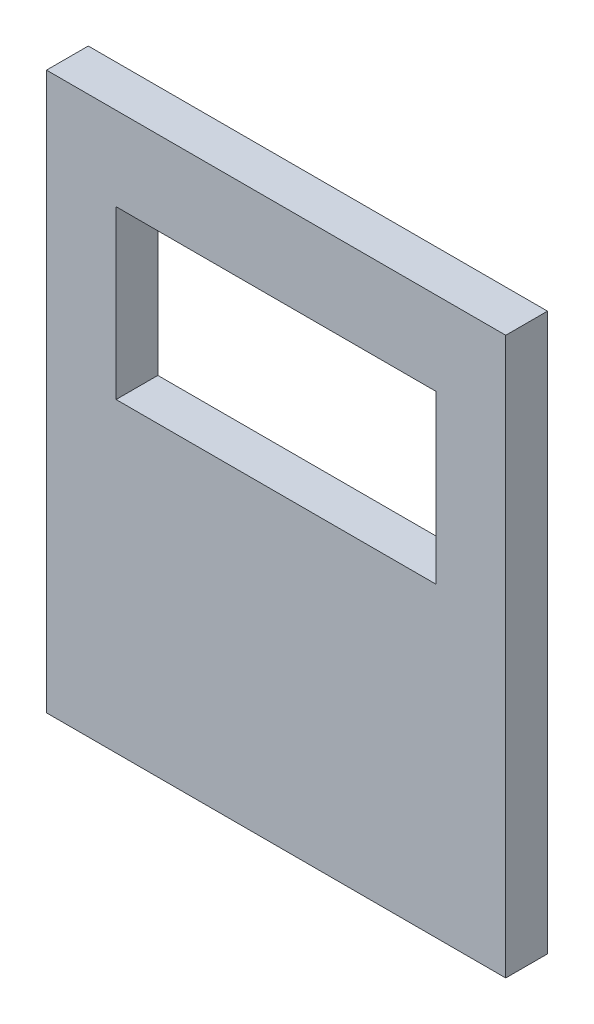
from build123d import *

# Parameters (mm, degrees)
SKETCH1_W           = 33
SKETCH1_H           = 40
SKETCH1_W_2         = 23
SKETCH1_H_2         = 12
BOSS_EXTRUDE1_DEPTH = 3


with BuildPart() as part:
    # Sketch1 → Boss-Extrude1 (new body)
    with BuildSketch(Plane.XY):
        Rectangle(SKETCH1_W, SKETCH1_H)
        with Locations((0, 8)):
            Rectangle(SKETCH1_W_2, SKETCH1_H_2, mode=Mode.SUBTRACT)
    extrude(amount=BOSS_EXTRUDE1_DEPTH)


solid = part.part
